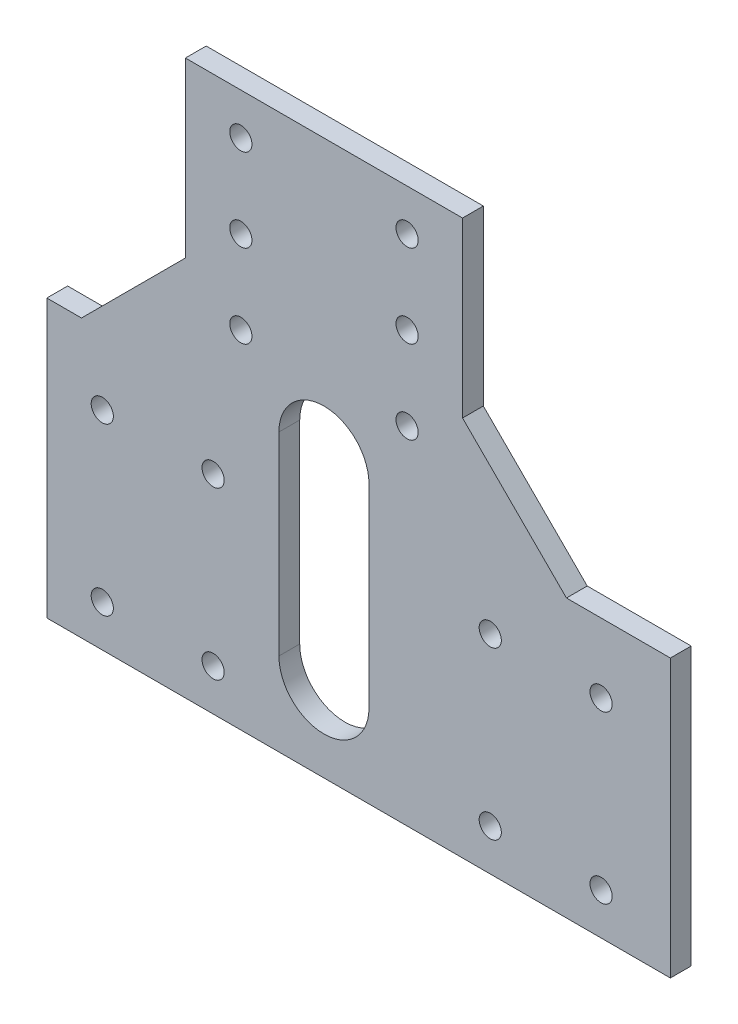
from build123d import *

# Parameters (mm, degrees)
EXTRUDE_1_DEPTH     = 3
SKETCH_2_R          = 1.6
CUT_EXTRUDE_1_DEPTH = 3


with BuildPart() as part:
    # 草图1 → 凸台-拉伸1 (new body)
    with BuildSketch(Plane.XY):
        Polygon((0, 0), (0, 40), (5, 40), (20, 55), (20, 80), (60, 80), (60, 55), (75, 40), (90, 40), (90, 0), align=None)
    extrude(amount=EXTRUDE_1_DEPTH)

    # 草图2 → 切除-拉伸1 (cut)
    with BuildSketch(Plane.XY.offset(3)):
        with Locations((28, 74)):
            Circle(SKETCH_2_R)
        with Locations((28, 50)):
            Circle(SKETCH_2_R)
        with Locations((52, 74)):
            Circle(SKETCH_2_R)
        with Locations((52, 50)):
            Circle(SKETCH_2_R)
        with Locations((8, 30)):
            Circle(SKETCH_2_R)
        with Locations((24, 30)):
            Circle(SKETCH_2_R)
        with Locations((80, 30)):
            Circle(SKETCH_2_R)
        with Locations((64, 30)):
            Circle(SKETCH_2_R)
        with Locations((80, 6)):
            Circle(SKETCH_2_R)
        with Locations((64, 6)):
            Circle(SKETCH_2_R)
        with Locations((24, 6)):
            Circle(SKETCH_2_R)
        with Locations((8, 6)):
            Circle(SKETCH_2_R)
        with Locations((28, 62)):
            Circle(SKETCH_2_R)
        with Locations((52, 62)):
            Circle(SKETCH_2_R)
        with BuildLine():
            Line((46.5, 40), (46.5, 12))
            ThreePointArc((46.5, 12), (40, 5.5), (33.5, 12))
            Line((33.5, 12), (33.5, 40))
            ThreePointArc((33.5, 40), (40, 46.5), (46.5, 40))
        make_face()
    extrude(amount=-CUT_EXTRUDE_1_DEPTH, mode=Mode.SUBTRACT)


solid = part.part
